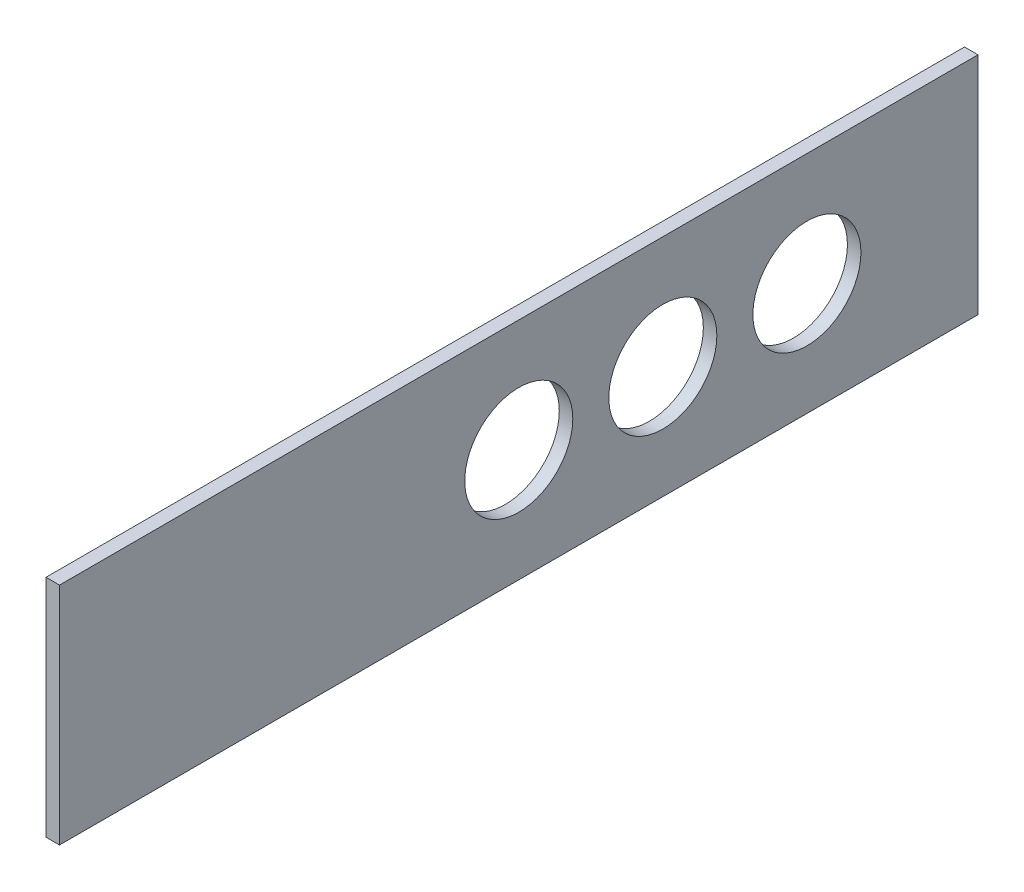
from build123d import *

# Parameters (mm, degrees)
SKETCH1_W           = 204
SKETCH1_H           = 50
SKETCH1_R           = 12
BOSS_EXTRUDE1_DEPTH = 3


with BuildPart() as part:
    # Sketch1 → Boss-Extrude1 (new body)
    with BuildSketch(Plane(origin=(0, 0, 6.996601353), x_dir=(0, 0, -1), z_dir=(1, 0, 0))):
        with Locations((33.317835299, 12.848528784)):
            Rectangle(SKETCH1_W, SKETCH1_H)
        with Locations((97.317835299, 12.848528784)):
            Circle(SKETCH1_R, mode=Mode.SUBTRACT)
        with Locations((33.317835299, 12.848528784)):
            Circle(SKETCH1_R, mode=Mode.SUBTRACT)
        with Locations((65.317835299, 12.848528784)):
            Circle(SKETCH1_R, mode=Mode.SUBTRACT)
    extrude(amount=BOSS_EXTRUDE1_DEPTH)


solid = part.part
